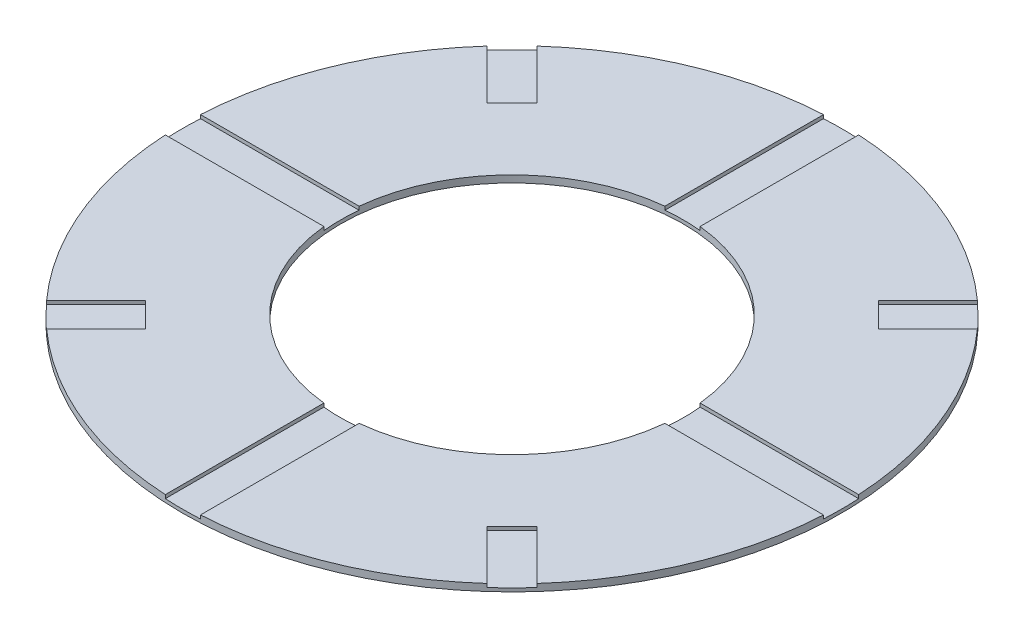
from build123d import *

# Parameters (mm, degrees)
CROQUIS2_R              = 9.365
CROQUIS2_R_2            = 4.87
SALIENTE_EXTRUIR1_DEPTH = 0.2
CORTAR_EXTRUIR1_START   = -0.1
CORTAR_EXTRUIR1_DEPTH   = 0.1


with BuildPart() as part:
    # Croquis2 → Saliente-Extruir1 (new body)
    with BuildSketch(Plane(origin=(0, 0, 0), x_dir=(1, 0, 0), z_dir=(0, 1, 0))):
        with Locations(Location((0, 0, 0), (0, 0, 270))):
            Circle(CROQUIS2_R)
        with Locations(Location((0, 0, 0), (0, 0, 270))):
            Circle(CROQUIS2_R_2, mode=Mode.SUBTRACT)
    extrude(amount=SALIENTE_EXTRUIR1_DEPTH)

    # Croquis3 → Cortar-Extruir1 (cut)
    with BuildSketch(Plane(origin=(0, 0.2, 0), x_dir=(1, 0, 0), z_dir=(0, 1, 0)).offset(CORTAR_EXTRUIR1_START)):
        with BuildLine():
            Line((-0.5, 9.351642904), (-0.5, 4.84426465))
            ThreePointArc((-0.5, 4.84426465), (0, 4.87), (0.5, 4.84426465))
            Line((0.5, 4.84426465), (0.5, 9.351642904))
            ThreePointArc((0.5, 9.351642904), (0.25008919, 9.36166013), (0, 9.365))
            ThreePointArc((0, 9.365), (-0.25008919, 9.36166013), (-0.5, 9.351642904))
        make_face()
        with BuildLine():
            ThreePointArc((0.5, -4.84426465), (0, -4.87), (-0.5, -4.84426465))
            Line((-0.5, -4.84426465), (-0.5, -9.351642904))
            ThreePointArc((-0.5, -9.351642904), (-0.25008919, -9.36166013), (0, -9.365))
            ThreePointArc((0, -9.365), (0.25008919, -9.36166013), (0.5, -9.351642904))
            Line((0.5, -9.351642904), (0.5, -4.84426465))
        make_face()
        with BuildLine():
            Line((-4.84426465, 0.5), (-9.351642904, 0.5))
            ThreePointArc((-9.351642904, 0.5), (-9.36166013, 0.25008919), (-9.365, 0))
            ThreePointArc((-9.365, 0), (-9.36166013, -0.25008919), (-9.351642904, -0.5))
            Line((-9.351642904, -0.5), (-4.84426465, -0.5))
            ThreePointArc((-4.84426465, -0.5), (-4.87, 0), (-4.84426465, 0.5))
        make_face()
        with BuildLine():
            Line((9.351642904, 0.5), (4.84426465, 0.5))
            ThreePointArc((4.84426465, 0.5), (4.863561907, 0.250330935), (4.87, 0))
            ThreePointArc((4.87, 0), (4.863561907, -0.250330935), (4.84426465, -0.5))
            Line((4.84426465, -0.5), (9.351642904, -0.5))
            ThreePointArc((9.351642904, -0.5), (9.36166013, -0.25008919), (9.365, 0))
            ThreePointArc((9.365, 0), (9.36166013, 0.25008919), (9.351642904, 0.5))
        make_face()
        with BuildLine():
            ThreePointArc((6.622055006, 6.622055006), (6.442853599, 6.796533124), (6.259056722, 6.966163503))
            Line((6.259056722, 6.966163503), (4.854288053, 5.561394834))
            Line((4.854288053, 5.561394834), (5.561394834, 4.854288053))
            Line((5.561394834, 4.854288053), (6.966163503, 6.259056722))
            ThreePointArc((6.966163503, 6.259056722), (6.796533124, 6.442853599), (6.622055006, 6.622055006))
        make_face()
        with BuildLine():
            Line((4.854288053, -5.561394834), (6.259056722, -6.966163503))
            ThreePointArc((6.259056722, -6.966163503), (6.442853599, -6.796533124), (6.622055006, -6.622055006))
            ThreePointArc((6.622055006, -6.622055006), (6.796533124, -6.442853599), (6.966163503, -6.259056722))
            Line((6.966163503, -6.259056722), (5.561394834, -4.854288053))
            Line((5.561394834, -4.854288053), (4.854288053, -5.561394834))
        make_face()
        with BuildLine():
            Line((-5.561394834, -4.854288053), (-6.966163503, -6.259056722))
            ThreePointArc((-6.966163503, -6.259056722), (-6.796533124, -6.442853599), (-6.622055006, -6.622055006))
            ThreePointArc((-6.622055006, -6.622055006), (-6.442853599, -6.796533124), (-6.259056722, -6.966163503))
            Line((-6.259056722, -6.966163503), (-4.854288053, -5.561394834))
            Line((-4.854288053, -5.561394834), (-5.561394834, -4.854288053))
        make_face()
        Polygon((-4.854288053, 5.561394834), (-5.561394834, 4.854288053), (-6.975608396, 6.268501615), (-6.268501615, 6.975608396), align=None)
    extrude(amount=CORTAR_EXTRUIR1_DEPTH, mode=Mode.SUBTRACT)


solid = part.part
